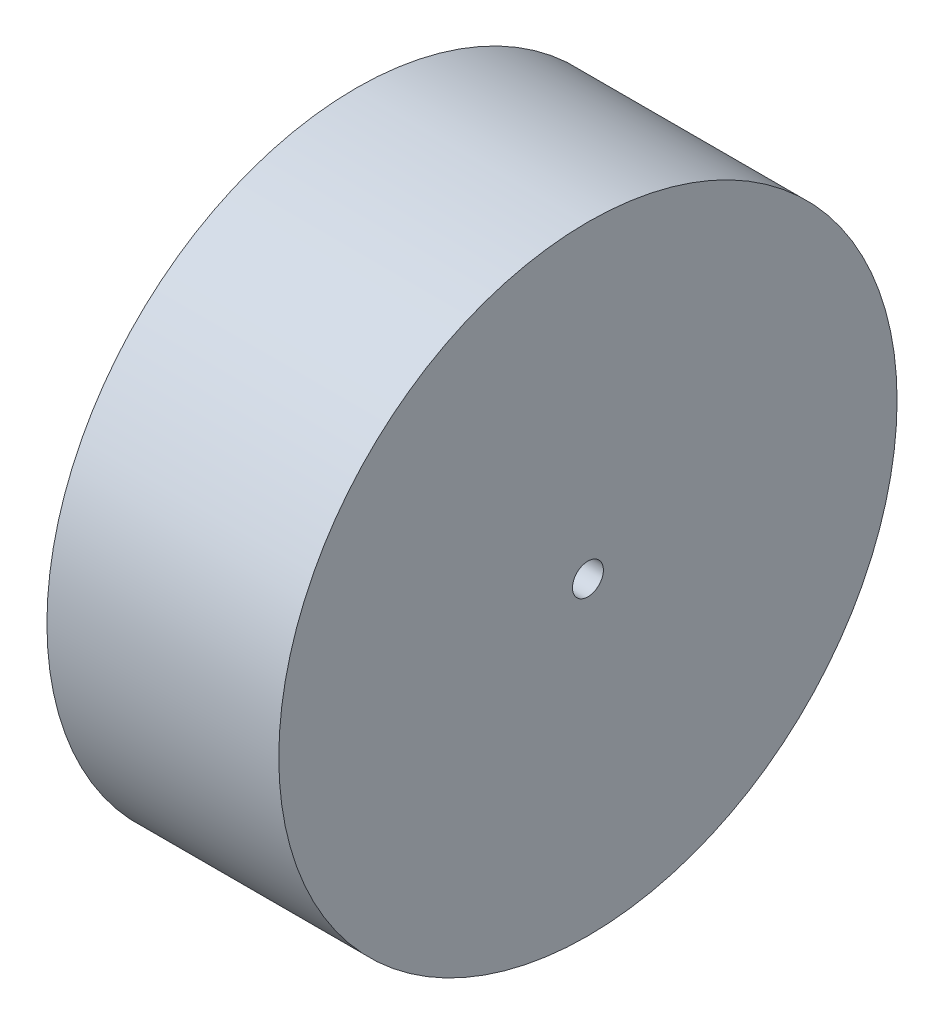
from build123d import *

# Parameters (mm, degrees)
SKETCH1_R           = 20
SKETCH1_R_2         = 1
BOSS_EXTRUDE1_DEPTH = 15


with BuildPart() as part:
    # Sketch1 → Boss-Extrude1 (new body)
    with BuildSketch(Plane(origin=(0, 0, 0), x_dir=(0, 0, -1), z_dir=(1, 0, 0))):
        Circle(SKETCH1_R)
        Circle(SKETCH1_R_2, mode=Mode.SUBTRACT)
    extrude(amount=BOSS_EXTRUDE1_DEPTH)


solid = part.part
